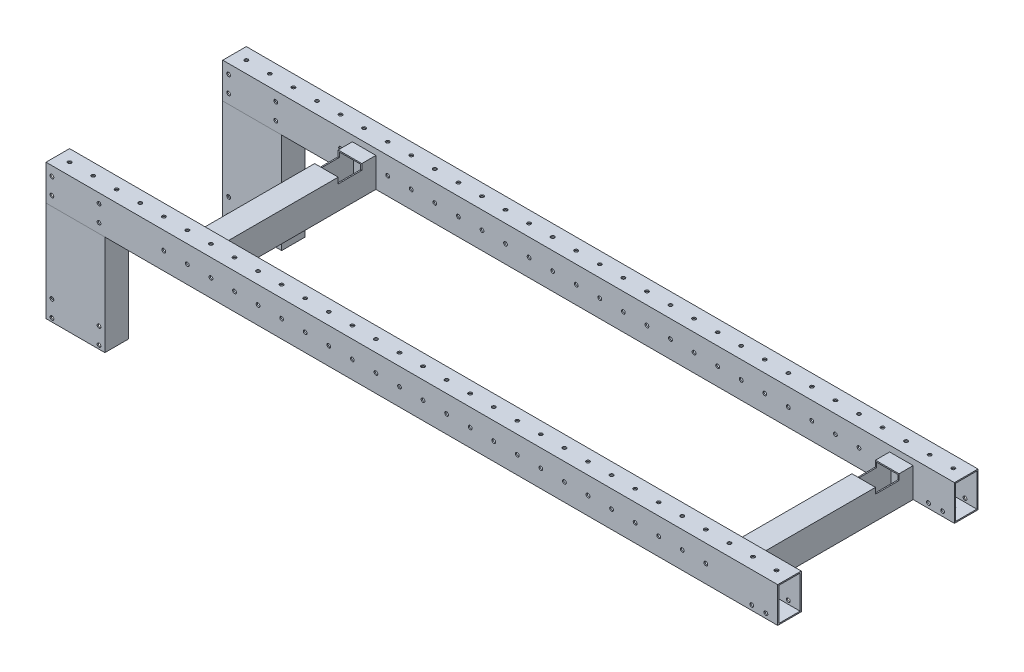
from build123d import *

# Parameters (mm, degrees)
SKETCH1_W                = 20
SKETCH1_H                = 30
SKETCH1_W_2              = 18
SKETCH1_H_2              = 28
F_20_X_20_X_2_1_DEPTH    = 621
SKETCH1_ON_SEGMENT_2_W   = 20
SKETCH1_ON_SEGMENT_2_H   = 30
SKETCH1_ON_SEGMENT_2_W_2 = 18
SKETCH1_ON_SEGMENT_2_H_2 = 28
F_20_X_20_X_2_1_2_DEPTH  = 621
SKETCH_3_R               = 1.6
CUT_EXTRUDE_1_DEPTH      = 645.023291504
SKETCH_5_R               = 1.5
CUT_EXTRUDE_3_DEPTH      = 628.507768876
EXTRUDE_1_REACH          = 641.035
SKETCH_8_W               = 20
SKETCH_8_H               = 25
SKETCH_8_W_2             = 18
SKETCH_8_H_2             = 23
CUT_EXTRUDE_4_REACH      = 594.323
SKETCH_9_W               = 20
SKETCH_9_H               = 5
SKETCH_6_R               = 1.6
CUT_EXTRUDE_5_DEPTH      = 645.023291504
SKETCH_10_W              = 50
SKETCH_10_H              = 20
SKETCH_10_W_2            = 48
SKETCH_10_H_2            = 18
EXTRUDE_2_DEPTH          = 85
SKETCH_11_R              = 1.6
CUT_EXTRUDE_6_DEPTH      = 652.568108489
PATTERN_LINEAR_1_COUNT   = 2
PATTERN_LINEAR_1_PITCH   = 456
SKETCH_12_R              = 1.6
CUT_EXTRUDE_7_DEPTH      = 652.568108489


with BuildPart() as part:
    # Sketch1 → 方形管 20 X 20 X 2(1) (new body)
    with BuildSketch(Plane(origin=(0, 0, 75), x_dir=(0, 0, -1), z_dir=(1, 0, 0))):
        Rectangle(SKETCH1_W, SKETCH1_H)
        Rectangle(SKETCH1_W_2, SKETCH1_H_2, mode=Mode.SUBTRACT)
    extrude(amount=F_20_X_20_X_2_1_DEPTH)


with BuildPart() as body_2:
    # Sketch1 on segment 2 (carried to segment 2) → 20 X 20 X 2_1 2 (new body)
    with BuildSketch(Plane(origin=(0, 0, -75), x_dir=(0, 0, -1), z_dir=(1, 0, 0))):
        Rectangle(SKETCH1_ON_SEGMENT_2_W, SKETCH1_ON_SEGMENT_2_H)
        Rectangle(SKETCH1_ON_SEGMENT_2_W_2, SKETCH1_ON_SEGMENT_2_H_2, mode=Mode.SUBTRACT)
    extrude(amount=F_20_X_20_X_2_1_2_DEPTH)


with BuildPart() as cut_extrude_1_tool:
    # 草图3 → 切除-拉伸1 (new, through all)
    with BuildSketch(Plane.XY.offset(85)):
        with Locations(Location((45, 7, 0), (0, 0, 90))):
            Circle(SKETCH_3_R)
        with Locations(Location((5, 7, 0), (0, 0, 90))):
            Circle(SKETCH_3_R)
        with Locations(Location((45, -7, 0), (0, 0, 90))):
            Circle(SKETCH_3_R)
        with Locations(Location((5, -7, 0), (0, 0, 90))):
            Circle(SKETCH_3_R)
    extrude(amount=-CUT_EXTRUDE_1_DEPTH)


with BuildPart() as part_1:
    add(part.part)

    # 切除-拉伸1: cut by cut_extrude_1_tool
    add(cut_extrude_1_tool.part, mode=Mode.SUBTRACT)


with BuildPart() as body_2_1:
    add(body_2.part)

    # 切除-拉伸1: cut by cut_extrude_1_tool
    add(cut_extrude_1_tool.part, mode=Mode.SUBTRACT)


with BuildPart() as cut_extrude_3_tool:
    # 草图5 → 切除-拉伸3 (new, through all)
    with BuildSketch(Plane(origin=(0, 15, 0), x_dir=(1, 0, 0), z_dir=(0, 1, 0))):
        with Locations(Location((10, -75, 0), (0, 0, 270))):
            Circle(SKETCH_5_R)
        with Locations(Location((10, 75, 0), (0, 0, 90))):
            Circle(SKETCH_5_R)
        with Locations(Location((30, 75, 0), (0, 0, 90))):
            Circle(SKETCH_5_R)
        with Locations(Location((30, -75, 0), (0, 0, 270))):
            Circle(SKETCH_5_R)
        with Locations(Location((50, 75, 0), (0, 0, 90))):
            Circle(SKETCH_5_R)
        with Locations(Location((50, -75, 0), (0, 0, 270))):
            Circle(SKETCH_5_R)
        with Locations(Location((70, 75, 0), (0, 0, 90))):
            Circle(SKETCH_5_R)
        with Locations(Location((70, -75, 0), (0, 0, 270))):
            Circle(SKETCH_5_R)
        with Locations(Location((90, 75, 0), (0, 0, 90))):
            Circle(SKETCH_5_R)
        with Locations(Location((90, -75, 0), (0, 0, 270))):
            Circle(SKETCH_5_R)
        with Locations(Location((110, 75, 0), (0, 0, 90))):
            Circle(SKETCH_5_R)
        with Locations(Location((110, -75, 0), (0, 0, 270))):
            Circle(SKETCH_5_R)
        with Locations(Location((130, 75, 0), (0, 0, 90))):
            Circle(SKETCH_5_R)
        with Locations(Location((130, -75, 0), (0, 0, 270))):
            Circle(SKETCH_5_R)
        with Locations(Location((150, 75, 0), (0, 0, 90))):
            Circle(SKETCH_5_R)
        with Locations(Location((150, -75, 0), (0, 0, 270))):
            Circle(SKETCH_5_R)
        with Locations(Location((170, 75, 0), (0, 0, 90))):
            Circle(SKETCH_5_R)
        with Locations(Location((170, -75, 0), (0, 0, 270))):
            Circle(SKETCH_5_R)
        with Locations(Location((190, 75, 0), (0, 0, 90))):
            Circle(SKETCH_5_R)
        with Locations(Location((190, -75, 0), (0, 0, 270))):
            Circle(SKETCH_5_R)
        with Locations(Location((210, 75, 0), (0, 0, 90))):
            Circle(SKETCH_5_R)
        with Locations(Location((210, -75, 0), (0, 0, 270))):
            Circle(SKETCH_5_R)
        with Locations(Location((230, 75, 0), (0, 0, 90))):
            Circle(SKETCH_5_R)
        with Locations(Location((230, -75, 0), (0, 0, 270))):
            Circle(SKETCH_5_R)
        with Locations(Location((250, 75, 0), (0, 0, 90))):
            Circle(SKETCH_5_R)
        with Locations(Location((250, -75, 0), (0, 0, 270))):
            Circle(SKETCH_5_R)
        with Locations(Location((270, 75, 0), (0, 0, 90))):
            Circle(SKETCH_5_R)
        with Locations(Location((270, -75, 0), (0, 0, 270))):
            Circle(SKETCH_5_R)
        with Locations(Location((290, 75, 0), (0, 0, 90))):
            Circle(SKETCH_5_R)
        with Locations(Location((290, -75, 0), (0, 0, 270))):
            Circle(SKETCH_5_R)
        with Locations(Location((310, 75, 0), (0, 0, 90))):
            Circle(SKETCH_5_R)
        with Locations(Location((310, -75, 0), (0, 0, 270))):
            Circle(SKETCH_5_R)
        with Locations(Location((330, 75, 0), (0, 0, 90))):
            Circle(SKETCH_5_R)
        with Locations(Location((330, -75, 0), (0, 0, 270))):
            Circle(SKETCH_5_R)
        with Locations(Location((350, 75, 0), (0, 0, 90))):
            Circle(SKETCH_5_R)
        with Locations(Location((350, -75, 0), (0, 0, 270))):
            Circle(SKETCH_5_R)
        with Locations(Location((370, 75, 0), (0, 0, 90))):
            Circle(SKETCH_5_R)
        with Locations(Location((370, -75, 0), (0, 0, 270))):
            Circle(SKETCH_5_R)
        with Locations(Location((390, 75, 0), (0, 0, 90))):
            Circle(SKETCH_5_R)
        with Locations(Location((390, -75, 0), (0, 0, 270))):
            Circle(SKETCH_5_R)
        with Locations(Location((410, 75, 0), (0, 0, 90))):
            Circle(SKETCH_5_R)
        with Locations(Location((410, -75, 0), (0, 0, 270))):
            Circle(SKETCH_5_R)
        with Locations(Location((430, 75, 0), (0, 0, 90))):
            Circle(SKETCH_5_R)
        with Locations(Location((430, -75, 0), (0, 0, 270))):
            Circle(SKETCH_5_R)
        with Locations(Location((450, 75, 0), (0, 0, 90))):
            Circle(SKETCH_5_R)
        with Locations(Location((450, -75, 0), (0, 0, 270))):
            Circle(SKETCH_5_R)
        with Locations(Location((470, 75, 0), (0, 0, 90))):
            Circle(SKETCH_5_R)
        with Locations(Location((470, -75, 0), (0, 0, 270))):
            Circle(SKETCH_5_R)
        with Locations(Location((490, 75, 0), (0, 0, 90))):
            Circle(SKETCH_5_R)
        with Locations(Location((490, -75, 0), (0, 0, 270))):
            Circle(SKETCH_5_R)
        with Locations(Location((510, 75, 0), (0, 0, 90))):
            Circle(SKETCH_5_R)
        with Locations(Location((510, -75, 0), (0, 0, 270))):
            Circle(SKETCH_5_R)
        with Locations(Location((530, 75, 0), (0, 0, 90))):
            Circle(SKETCH_5_R)
        with Locations(Location((530, -75, 0), (0, 0, 270))):
            Circle(SKETCH_5_R)
        with Locations(Location((550, 75, 0), (0, 0, 90))):
            Circle(SKETCH_5_R)
        with Locations(Location((550, -75, 0), (0, 0, 270))):
            Circle(SKETCH_5_R)
        with Locations(Location((570, 75, 0), (0, 0, 90))):
            Circle(SKETCH_5_R)
        with Locations(Location((570, -75, 0), (0, 0, 270))):
            Circle(SKETCH_5_R)
        with Locations(Location((590, 75, 0), (0, 0, 90))):
            Circle(SKETCH_5_R)
        with Locations(Location((590, -75, 0), (0, 0, 270))):
            Circle(SKETCH_5_R)
        with Locations(Location((610, 75, 0), (0, 0, 90))):
            Circle(SKETCH_5_R)
        with Locations(Location((610, -75, 0), (0, 0, 270))):
            Circle(SKETCH_5_R)
    extrude(amount=-CUT_EXTRUDE_3_DEPTH)


with BuildPart() as part_2:
    add(part_1.part)

    # 切除-拉伸3: cut by cut_extrude_3_tool
    add(cut_extrude_3_tool.part, mode=Mode.SUBTRACT)


with BuildPart() as body_2_2:
    add(body_2_1.part)

    # 切除-拉伸3: cut by cut_extrude_3_tool
    add(cut_extrude_3_tool.part, mode=Mode.SUBTRACT)


with BuildPart() as body_3:

    # 草图8 → 凸台-拉伸1 (new, up to next)
    with BuildSketch(Plane(origin=(0, 0, 65), x_dir=(-1, 0, 0), z_dir=(0, 0, -1)), mode=Mode.PRIVATE) as extrude_1_sk1:
        with Locations((-576, -2.5)):
            Rectangle(SKETCH_8_W, SKETCH_8_H)
        with Locations((-576, -2.5)):
            Rectangle(SKETCH_8_W_2, SKETCH_8_H_2, mode=Mode.SUBTRACT)
    extrude_1_tool1 = extrude(extrude_1_sk1.sketch, amount=EXTRUDE_1_REACH, mode=Mode.PRIVATE) - body_2_2.part
    add(extrude_1_tool1.solids().sort_by_distance((576, 9.679844, 65))[0])

    # 切除-拉伸4: up to this face of the body (flat: up to its plane)
    cut_extrude_4_end = Plane(body_3.part.faces().sort_by_distance((566, -2.5, 0))[0])
    # 草图9 → 切除-拉伸4 (cut, up to the picked face)
    with BuildSketch(Plane(origin=(586, 0, 0), x_dir=(0, 0, -1), z_dir=(1, 0, 0)), mode=Mode.PRIVATE) as cut_extrude_4_sk1:
        with Locations((43, 7.5)):
            Rectangle(SKETCH_9_W, SKETCH_9_H)
    cut_extrude_4_tool1 = split(extrude(cut_extrude_4_sk1.sketch, amount=-CUT_EXTRUDE_4_REACH, mode=Mode.PRIVATE), bisect_by=cut_extrude_4_end, keep=Keep.BOTH, mode=Mode.PRIVATE)
    add(cut_extrude_4_tool1.solids().sort_by(Axis((586, 7.5, -43), (-1, 0, 0)))[0], mode=Mode.SUBTRACT)


with BuildPart() as cut_extrude_5_tool:
    # 草图6 → 切除-拉伸5 (new, through all)
    with BuildSketch(Plane.XY.offset(85)):
        with Locations(Location((599, -11, 0), (0, 0, 90))):
            Circle(SKETCH_6_R)
        with Locations(Location((611, -11, 0), (0, 0, 90))):
            Circle(SKETCH_6_R)
    extrude(amount=-CUT_EXTRUDE_5_DEPTH)


with BuildPart() as part_3:
    add(part_2.part)

    # 切除-拉伸5: cut by cut_extrude_5_tool
    add(cut_extrude_5_tool.part, mode=Mode.SUBTRACT)


with BuildPart() as body_2_3:
    add(body_2_2.part)

    # 切除-拉伸5: cut by cut_extrude_5_tool
    add(cut_extrude_5_tool.part, mode=Mode.SUBTRACT)


with BuildPart() as body_4:
    # 草图10 → 凸台-拉伸2 (new body)
    with BuildSketch(Plane.XZ.offset(15)):
        with Locations((25, 75)):
            Rectangle(SKETCH_10_W, SKETCH_10_H)
        with Locations((25, 75)):
            Rectangle(SKETCH_10_W_2, SKETCH_10_H_2, mode=Mode.SUBTRACT)
    extrude(amount=EXTRUDE_2_DEPTH)

    # 草图11 → 切除-拉伸6 (cut, through all)
    with BuildSketch(Plane.XY.offset(85)):
        with Locations((45, -83)):
            Circle(SKETCH_11_R)
        with Locations((45, -97)):
            Circle(SKETCH_11_R)
        with Locations((5, -97)):
            Circle(SKETCH_11_R)
        with Locations((5, -83)):
            Circle(SKETCH_11_R)
    extrude(amount=-CUT_EXTRUDE_6_DEPTH, mode=Mode.SUBTRACT)


with BuildPart() as body_5:
    # 镜向1: mirrored copy
    add(body_4.part.mirror(Plane.XY))


with BuildPart() as pattern_linear_1_1:
    # 阵列(线性)1: pattern copy
    add(body_3.part.moved(Location(Vector(-1, 0, 0) * (1 * PATTERN_LINEAR_1_PITCH))))


with BuildPart() as cut_extrude_7_tool:
    # 草图12 → 切除-拉伸7 (new, through all)
    with BuildSketch(Plane.XY.offset(85)):
        with Locations(Location((100, 0, 0), (0, 0, 90))):
            Circle(SKETCH_12_R)
        with Locations(Location((120, 0, 0), (0, 0, 90))):
            Circle(SKETCH_12_R)
        with Locations(Location((140, 0, 0), (0, 0, 90))):
            Circle(SKETCH_12_R)
        with Locations(Location((160, 0, 0), (0, 0, 90))):
            Circle(SKETCH_12_R)
        with Locations(Location((180, 0, 0), (0, 0, 90))):
            Circle(SKETCH_12_R)
        with Locations(Location((200, 0, 0), (0, 0, 90))):
            Circle(SKETCH_12_R)
        with Locations(Location((220, 0, 0), (0, 0, 90))):
            Circle(SKETCH_12_R)
        with Locations(Location((240, 0, 0), (0, 0, 90))):
            Circle(SKETCH_12_R)
        with Locations(Location((260, 0, 0), (0, 0, 90))):
            Circle(SKETCH_12_R)
        with Locations(Location((280, 0, 0), (0, 0, 90))):
            Circle(SKETCH_12_R)
        with Locations(Location((300, 0, 0), (0, 0, 90))):
            Circle(SKETCH_12_R)
        with Locations(Location((320, 0, 0), (0, 0, 90))):
            Circle(SKETCH_12_R)
        with Locations(Location((340, 0, 0), (0, 0, 90))):
            Circle(SKETCH_12_R)
        with Locations(Location((360, 0, 0), (0, 0, 90))):
            Circle(SKETCH_12_R)
        with Locations(Location((380, 0, 0), (0, 0, 90))):
            Circle(SKETCH_12_R)
        with Locations(Location((400, 0, 0), (0, 0, 90))):
            Circle(SKETCH_12_R)
        with Locations(Location((420, 0, 0), (0, 0, 90))):
            Circle(SKETCH_12_R)
        with Locations(Location((440, 0, 0), (0, 0, 90))):
            Circle(SKETCH_12_R)
        with Locations(Location((460, 0, 0), (0, 0, 90))):
            Circle(SKETCH_12_R)
        with Locations(Location((480, 0, 0), (0, 0, 90))):
            Circle(SKETCH_12_R)
        with Locations(Location((500, 0, 0), (0, 0, 90))):
            Circle(SKETCH_12_R)
        with Locations(Location((520, 0, 0), (0, 0, 90))):
            Circle(SKETCH_12_R)
        with Locations(Location((540, 0, 0), (0, 0, 90))):
            Circle(SKETCH_12_R)
        with Locations(Location((560, 0, 0), (0, 0, 90))):
            Circle(SKETCH_12_R)
    extrude(amount=-CUT_EXTRUDE_7_DEPTH)


with BuildPart() as part_4:
    add(part_3.part)

    # 切除-拉伸7: cut by cut_extrude_7_tool
    add(cut_extrude_7_tool.part, mode=Mode.SUBTRACT)


with BuildPart() as body_2_4:
    add(body_2_3.part)

    # 切除-拉伸7: cut by cut_extrude_7_tool
    add(cut_extrude_7_tool.part, mode=Mode.SUBTRACT)


solid = Compound([body_3.part, body_4.part, body_5.part, pattern_linear_1_1.part, part_4.part, body_2_4.part])
